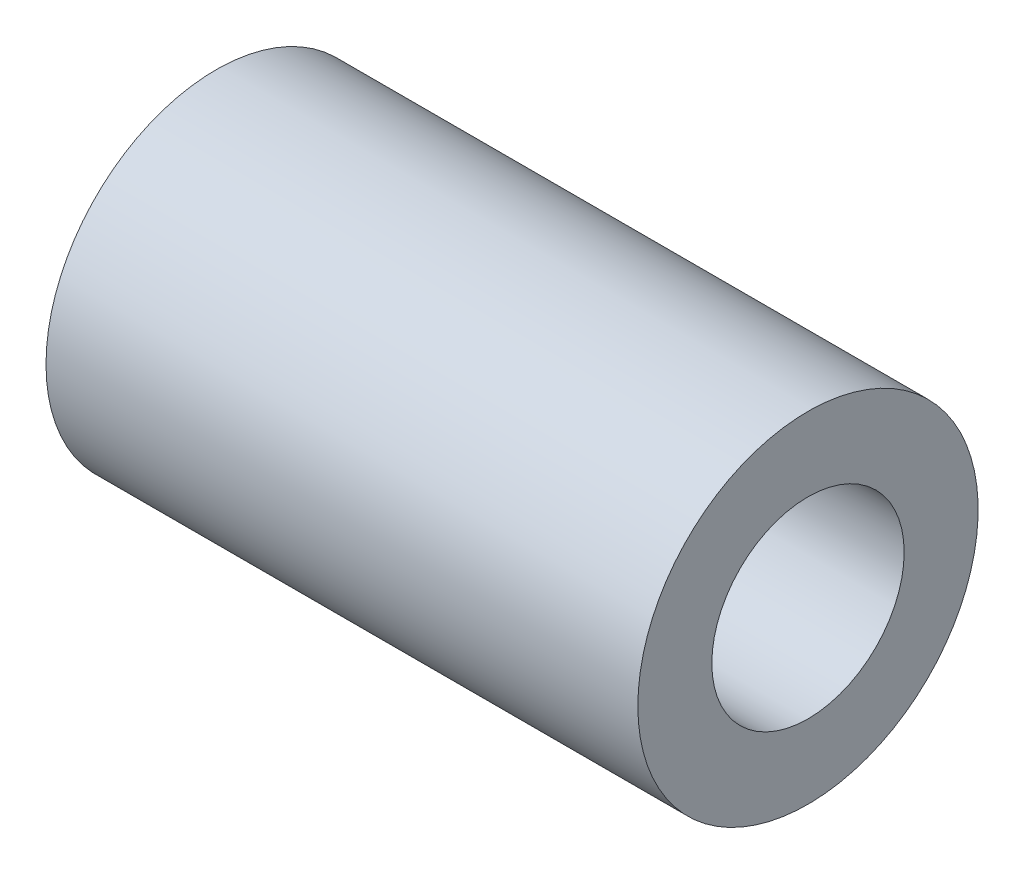
from build123d import *

# Parameters (mm, degrees)
SKETCH1_W                  = 24
SKETCH1_H                  = 6.9
F_7_8_7_8_DIAMETER_HOLE1_D = 7.8


with BuildPart() as part:
    # Sketch1 → Revolve1 (revolve)
    with BuildSketch(Plane.XY, mode=Mode.PRIVATE) as revolve1_sk:
        with Locations((12, 3.45)):
            Rectangle(SKETCH1_W, SKETCH1_H)
    revolve(revolve1_sk.sketch.rotate(Axis((-12.230030818, 0, 0), (1, 0, 0)), 90), axis=Axis((-12.230030818, 0, 0), (1, 0, 0)))

    # Ø7.8 (7.8) Diameter Hole1 (through all)
    with Locations(Plane.ZY):
        with Locations((0, 0)):
            Hole(F_7_8_7_8_DIAMETER_HOLE1_D / 2)


solid = part.part
